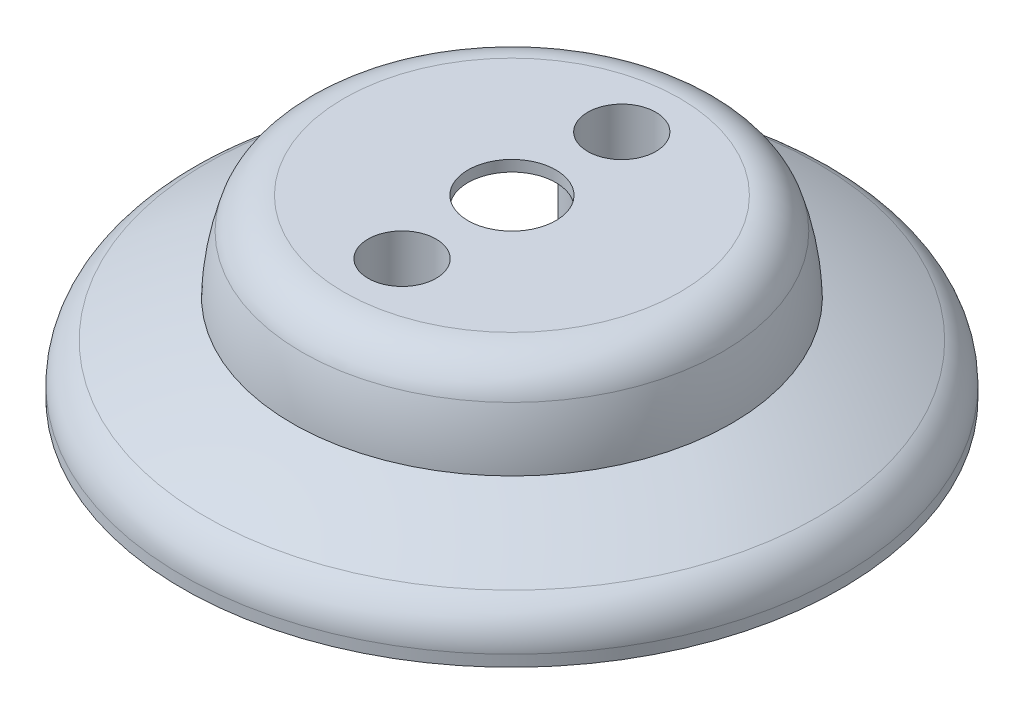
from build123d import *

# Parameters (mm, degrees)
CROQUIS5_R              = 2
CORTAR_EXTRUIR1_DEPTH   = 6
CROQUIS6_R              = 14.5
CORTAR_EXTRUIR2_DEPTH   = 0.5
CROQUIS7_R              = 2.05
CROQUIS7_R_2            = 1.55
SALIENTE_EXTRUIR1_DEPTH = 6.5
CORTAR_EXTRUIR3_START   = -5.5
CROQUIS8_R              = 1.55
CORTAR_EXTRUIR3_DEPTH   = 5.5
REDONDEO1_R             = 2
REDONDEO2_R             = 2


with BuildPart() as part:
    # Croquis3 → Revolución1 (revolve)
    with BuildSketch(Plane.XY):
        with BuildLine():
            Line((15, 0), (15, 1.694213924))
            ThreePointArc((15, 1.694213924), (12.549846274, 2.962329925), (9.993557502, 4))
            ThreePointArc((9.993557502, 4), (9.70509179, 6.051742746), (9, 8))
            Line((9, 8), (0, 8))
            Line((0, 8), (0, 0))
            Line((0, 0), (15, 0))
        make_face()
    revolve(axis=Axis((0, 0, 0), (0, 1, 0)))

    # Croquis4 → Cortar-Revolución1 (revolve, cut)
    with BuildSketch(Plane.XY):
        with BuildLine():
            Line((0, 0.5), (0, 7.5))
            Line((0, 7.5), (8.680950348, 7.5))
            ThreePointArc((8.680950348, 7.5), (9.292895722, 5.613938885), (9.499999964, 3.641931911))
            ThreePointArc((9.499999964, 3.641931911), (12.052061122, 2.639235415), (14.5, 1.403916968))
            Line((14.5, 1.403916968), (14.5, 0.5))
            Line((14.5, 0.5), (0, 0.5))
        make_face()
    revolve(axis=Axis((0, 7.5, 0), (0, 1, 0)), mode=Mode.SUBTRACT)

    # Croquis5 → Cortar-Extruir1 (cut)
    with BuildSketch(Plane(origin=(0, 8, 0), x_dir=(1, 0, 0), z_dir=(0, 1, 0))):
        with Locations(Location((0, 0, 0), (0, 0, 270))):
            Circle(CROQUIS5_R)
    extrude(amount=-CORTAR_EXTRUIR1_DEPTH, mode=Mode.SUBTRACT)

    # Croquis6 → Cortar-Extruir2 (cut)
    with BuildSketch(Plane.XZ):
        Circle(CROQUIS6_R)
    extrude(amount=-CORTAR_EXTRUIR2_DEPTH, mode=Mode.SUBTRACT)

    # Croquis7 → Saliente-Extruir1 (add)
    # profile 1 of 2: a face of its own
    with BuildSketch(Plane.XZ.offset(-7.5)):
        with Locations(Location((0, 5, 0), (0, 0, 90))):
            Circle(CROQUIS7_R)
        with Locations(Location((0, 5, 0), (0, 0, 90))):
            Circle(CROQUIS7_R_2, mode=Mode.SUBTRACT)
    # profile 2 of 2: a face of its own
    with BuildSketch(Plane.XZ.offset(-7.5)):
        with Locations(Location((0, -5, 0), (0, 0, 90))):
            Circle(CROQUIS7_R)
        with Locations(Location((0, -5, 0), (0, 0, 90))):
            Circle(CROQUIS7_R_2, mode=Mode.SUBTRACT)
    extrude(amount=SALIENTE_EXTRUIR1_DEPTH)

    # Croquis8 → Cortar-Extruir3 (cut)
    with BuildSketch(Plane.XZ.offset(-7.5).offset(CORTAR_EXTRUIR3_START)):
        with Locations(Location((0, -5, 0), (0, 0, 90))):
            Circle(CROQUIS8_R)
        with Locations(Location((0, 5, 0), (0, 0, 90))):
            Circle(CROQUIS8_R)
    extrude(amount=CORTAR_EXTRUIR3_DEPTH, mode=Mode.SUBTRACT)

    # Redondeo1
    redondeo1_edges = [part.edges().sort_by_distance(p)[0] for p in [
        (-9, 8, 0),
    ]]
    fillet(redondeo1_edges, radius=REDONDEO1_R)

    # Redondeo2
    redondeo2_edges = [part.edges().sort_by_distance(p)[0] for p in [
        (-15, 1.694213924, 0),
    ]]
    fillet(redondeo2_edges, radius=REDONDEO2_R)


solid = part.part
